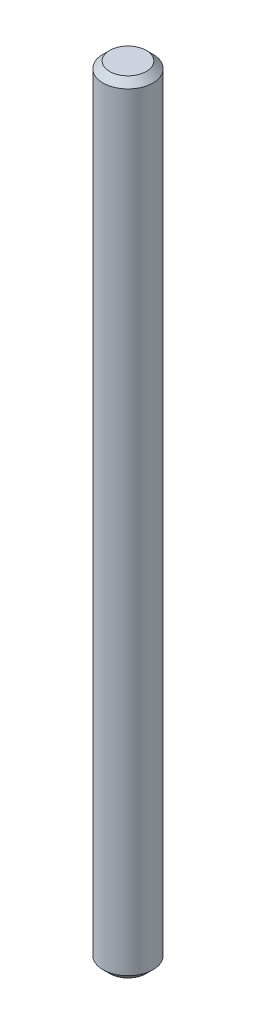
from build123d import *

# Parameters (mm, degrees)
SKICA1_R                = 0.75
P_IDAT_VYSUNUT_M1_DEPTH = 23.5
ZKOSEN_1_SIZE           = 0.2


with BuildPart() as part:
    # Skica1 → Přidat vysunutím1 (new body)
    with BuildSketch(Plane(origin=(0, 0, 0), x_dir=(1, 0, 0), z_dir=(0, 1, 0))):
        with Locations(Location((0, 0, 0), (0, 0, 270))):
            Circle(SKICA1_R)
    extrude(amount=P_IDAT_VYSUNUT_M1_DEPTH)

    # Zkosení1
    zkosen_1_edges = [part.edges().sort_by_distance(p)[0] for p in [
        (0, 0, -0.75),
        (0, 23.5, -0.75),
    ]]
    chamfer(zkosen_1_edges, length=ZKOSEN_1_SIZE)


solid = part.part
